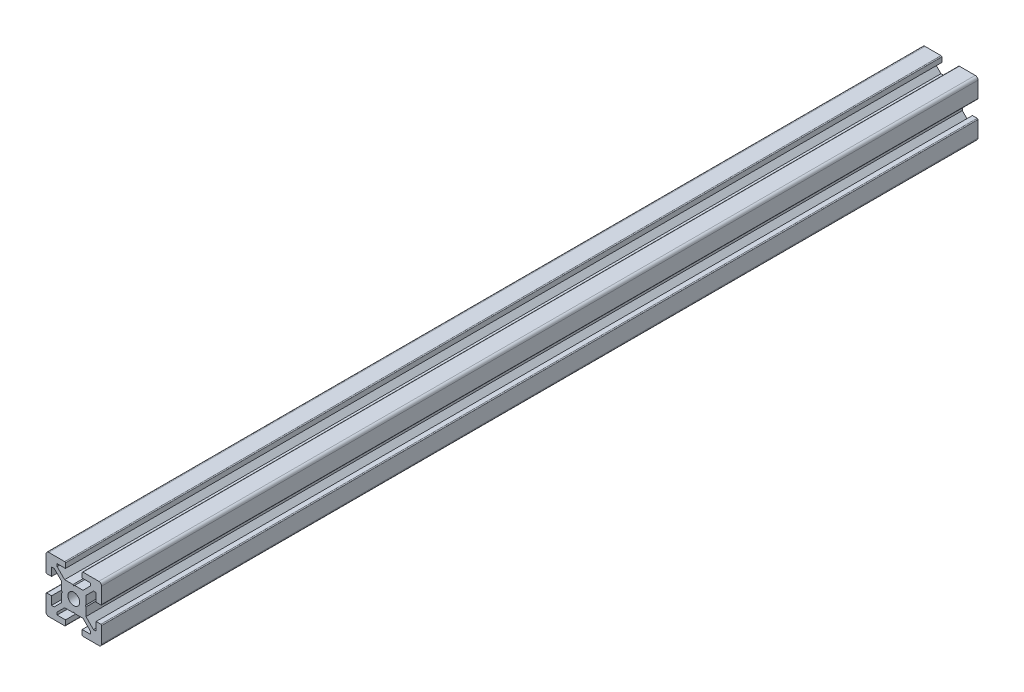
from build123d import *

# Parameters (mm, degrees)
SKETCH1_R           = 2.1
BOSS_EXTRUDE1_DEPTH = 315


with BuildPart() as part:
    # Sketch1 → Boss-Extrude1 (new body)
    with BuildSketch(Plane.XY):
        with BuildLine():
            Line((3.3, 4.360660172), (6.000039828, 7.0607))
            Line((6.000039828, 7.0607), (6.000039828, 8))
            Line((6.000039828, 8), (3.000039828, 8))
            Line((3.000039828, 8), (3.000039828, 9.7))
            ThreePointArc((3.000039828, 9.7), (3.087907794, 9.912132034), (3.300039828, 10))
            Line((3.300039828, 10), (9, 10))
            ThreePointArc((9, 10), (9.707106781, 9.707106781), (10, 9))
            Line((10, 9), (10, 3.300039828))
            ThreePointArc((10, 3.300039828), (9.912132034, 3.087907794), (9.7, 3.000039828))
            Line((9.7, 3.000039828), (8, 3.000039828))
            Line((8, 3.000039828), (8, 6.000039828))
            Line((8, 6.000039828), (7.0607, 6.000039828))
            Line((7.0607, 6.000039828), (4.360660172, 3.3))
            Line((4.360660172, 3.3), (4.360660172, 0.3))
            Line((4.360660172, 0.3), (4.060660172, 0))
            Line((4.060660172, 0), (4.360660172, -0.3))
            Line((4.360660172, -0.3), (4.360660172, -3.3))
            Line((4.360660172, -3.3), (7.0607, -6.000039828))
            Line((7.0607, -6.000039828), (8, -6.000039828))
            Line((8, -6.000039828), (8, -3.000039828))
            Line((8, -3.000039828), (9.7, -3.000039828))
            ThreePointArc((9.7, -3.000039828), (9.912132034, -3.087907794), (10, -3.300039828))
            Line((10, -3.300039828), (10, -9))
            ThreePointArc((10, -9), (9.707106781, -9.707106781), (9, -10))
            Line((9, -10), (3.300039828, -10))
            ThreePointArc((3.300039828, -10), (3.087907794, -9.912132034), (3.000039828, -9.7))
            Line((3.000039828, -9.7), (3.000039828, -8))
            Line((3.000039828, -8), (6.000039828, -8))
            Line((6.000039828, -8), (6.000039828, -7.0607))
            Line((6.000039828, -7.0607), (3.3, -4.360660172))
            Line((3.3, -4.360660172), (0.3, -4.360660172))
            Line((0.3, -4.360660172), (0, -4.060660172))
            Line((0, -4.060660172), (-0.3, -4.360660172))
            Line((-0.3, -4.360660172), (-3.3, -4.360660172))
            Line((-3.3, -4.360660172), (-6.000039828, -7.0607))
            Line((-6.000039828, -7.0607), (-6.000039828, -8))
            Line((-6.000039828, -8), (-3.000039828, -8))
            Line((-3.000039828, -8), (-3.000039828, -9.7))
            ThreePointArc((-3.000039828, -9.7), (-3.087907794, -9.912132034), (-3.300039828, -10))
            Line((-3.300039828, -10), (-9, -10))
            ThreePointArc((-9, -10), (-9.707106781, -9.707106781), (-10, -9))
            Line((-10, -9), (-10, -3.300039828))
            ThreePointArc((-10, -3.300039828), (-9.912132034, -3.087907794), (-9.7, -3.000039828))
            Line((-9.7, -3.000039828), (-8, -3.000039828))
            Line((-8, -3.000039828), (-8, -6.000039828))
            Line((-8, -6.000039828), (-7.0607, -6.000039828))
            Line((-7.0607, -6.000039828), (-4.360660172, -3.3))
            Line((-4.360660172, -3.3), (-4.360660172, -0.3))
            Line((-4.360660172, -0.3), (-4.060660172, 0))
            Line((-4.060660172, 0), (-4.360660172, 0.3))
            Line((-4.360660172, 0.3), (-4.360660172, 3.3))
            Line((-4.360660172, 3.3), (-7.0607, 6.000039828))
            Line((-7.0607, 6.000039828), (-8, 6.000039828))
            Line((-8, 6.000039828), (-8, 3.000039828))
            Line((-8, 3.000039828), (-9.7, 3.000039828))
            ThreePointArc((-9.7, 3.000039828), (-9.912132034, 3.087907794), (-10, 3.300039828))
            Line((-10, 3.300039828), (-10, 9))
            ThreePointArc((-10, 9), (-9.707106781, 9.707106781), (-9, 10))
            Line((-9, 10), (-3.300039828, 10))
            ThreePointArc((-3.300039828, 10), (-3.087907794, 9.912132034), (-3.000039828, 9.7))
            Line((-3.000039828, 9.7), (-3.000039828, 8))
            Line((-3.000039828, 8), (-6.000039828, 8))
            Line((-6.000039828, 8), (-6.000039828, 7.0607))
            Line((-6.000039828, 7.0607), (-3.3, 4.360660172))
            Line((-3.3, 4.360660172), (-0.3, 4.360660172))
            Line((-0.3, 4.360660172), (0, 4.060660172))
            Line((0, 4.060660172), (0.3, 4.360660172))
            Line((0.3, 4.360660172), (3.3, 4.360660172))
        make_face()
        Circle(SKETCH1_R, mode=Mode.SUBTRACT)
    extrude(amount=BOSS_EXTRUDE1_DEPTH)


solid = part.part
